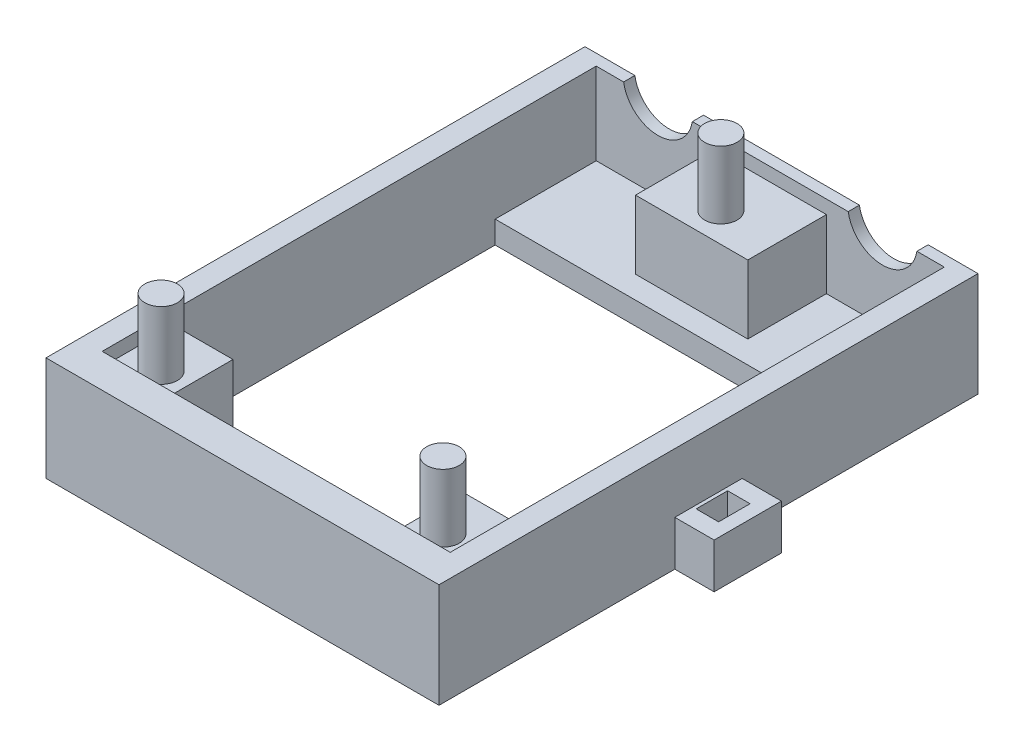
from build123d import *

# Parameters (mm, degrees)
SKETCH1_W           = 35
SKETCH1_H           = 48
BOSS_EXTRUDE1_DEPTH = 2
SKETCH2_W           = 35
SKETCH2_H           = 48
SKETCH2_W_2         = 31
SKETCH2_H_2         = 44
BOSS_EXTRUDE2_DEPTH = 7.3
SKETCH3_W           = 10
SKETCH3_H           = 7
SKETCH3_W_2         = 5.25
SKETCH3_H_2         = 6.4
BOSS_EXTRUDE3_DEPTH = 6.1
CUT_EXTRUDE5_DEPTH  = 1
SKETCH10_W          = 31
SKETCH10_H          = 28.6
CUT_EXTRUDE6_DEPTH  = 31.586598372
BOSS_EXTRUDE4_START = 8.1
SKETCH8_R           = 1.45
BOSS_EXTRUDE4_DEPTH = 6
SKETCH12_W          = 6
SKETCH12_H          = 4
BOSS_EXTRUDE5_DEPTH = 3.5
SKETCH13_W          = 2
SKETCH13_H          = 2.8
CUT_EXTRUDE7_DEPTH  = 4


with BuildPart() as part:
    # Sketch1 → Boss-Extrude1 (new body)
    with BuildSketch(Plane(origin=(0, 0, 0), x_dir=(1, 0, 0), z_dir=(0, 1, 0))):
        Rectangle(SKETCH1_W, SKETCH1_H)
    extrude(amount=BOSS_EXTRUDE1_DEPTH)

    # Sketch2 → Boss-Extrude2 (add)
    with BuildSketch(Plane(origin=(0, 2, 0), x_dir=(1, 0, 0), z_dir=(0, 1, 0))):
        Rectangle(SKETCH2_W, SKETCH2_H)
        with Locations((0, 1)):
            Rectangle(SKETCH2_W_2, SKETCH2_H_2, mode=Mode.SUBTRACT)
    extrude(amount=BOSS_EXTRUDE2_DEPTH)

    # Sketch3 → Boss-Extrude3 (add)
    with BuildSketch(Plane(origin=(0, 2, 0), x_dir=(1, 0, 0), z_dir=(0, 1, 0))):
        with Locations((0, 19.5)):
            Rectangle(SKETCH3_W, SKETCH3_H)
        with Locations((-12.875, -17.8)):
            Rectangle(SKETCH3_W_2, SKETCH3_H_2)
        with Locations((12.875, -17.8)):
            Rectangle(SKETCH3_W_2, SKETCH3_H_2)
    extrude(amount=BOSS_EXTRUDE3_DEPTH)

    # Sketch6 → Cut-Extrude5 (cut)
    with BuildSketch(Plane(origin=(0, 0, -24), x_dir=(-1, 0, 0), z_dir=(0, 0, -1))):
        with BuildLine():
            ThreePointArc((-13.059411708, 9.3), (-10, 6.7), (-6.940588292, 9.3))
            Line((-6.940588292, 9.3), (-13.059411708, 9.3))
        make_face()
        with BuildLine():
            Line((13.059411708, 9.3), (6.940588292, 9.3))
            ThreePointArc((6.940588292, 9.3), (10, 6.7), (13.059411708, 9.3))
        make_face()
    extrude(amount=-CUT_EXTRUDE5_DEPTH, mode=Mode.SUBTRACT)

    # Sketch10 → Cut-Extrude6 (cut, through all)
    with BuildSketch(Plane(origin=(0, 2, 0), x_dir=(1, 0, 0), z_dir=(0, 1, 0))):
        with Locations((0, -0.3)):
            Rectangle(SKETCH10_W, SKETCH10_H)
    extrude(amount=-CUT_EXTRUDE6_DEPTH, mode=Mode.SUBTRACT)

    # Sketch8 → Boss-Extrude4 (add)
    with BuildSketch(Plane(origin=(0, 0, 0), x_dir=(1, 0, 0), z_dir=(0, 1, 0)).offset(BOSS_EXTRUDE4_START)):
        with Locations(Location((-12.55, -18.7, 0), (0, 0, 90))):
            Circle(SKETCH8_R)
        with Locations(Location((12.55, -18.7, 0), (0, 0, 270))):
            Circle(SKETCH8_R)
        with Locations(Location((0, 18.6, 0), (0, 0, 270))):
            Circle(SKETCH8_R)
    extrude(amount=BOSS_EXTRUDE4_DEPTH)

    # Sketch12 → Boss-Extrude5 (add)
    with BuildSketch(Plane.ZY.offset(17.5)):
        with Locations((0, 2)):
            Rectangle(SKETCH12_W, SKETCH12_H)
    boss_extrude5 = extrude(amount=BOSS_EXTRUDE5_DEPTH)

    # Sketch13 → Cut-Extrude7 (cut)
    with BuildSketch(Plane(origin=(0, 4, 0), x_dir=(1, 0, 0), z_dir=(0, 1, 0))):
        with Locations((-18.8, 0)):
            Rectangle(SKETCH13_W, SKETCH13_H)
    cut_extrude7 = extrude(amount=-CUT_EXTRUDE7_DEPTH, mode=Mode.SUBTRACT)

    # Mirror1: Boss-Extrude5, Cut-Extrude7 across plane
    add(boss_extrude5.mirror(Plane(origin=(0, 0, 0), x_dir=(0, 0, 1), z_dir=(1, 0, 0))))
    add(cut_extrude7.mirror(Plane(origin=(0, 0, 0), x_dir=(0, 0, 1), z_dir=(1, 0, 0))), mode=Mode.SUBTRACT)


solid = part.part
